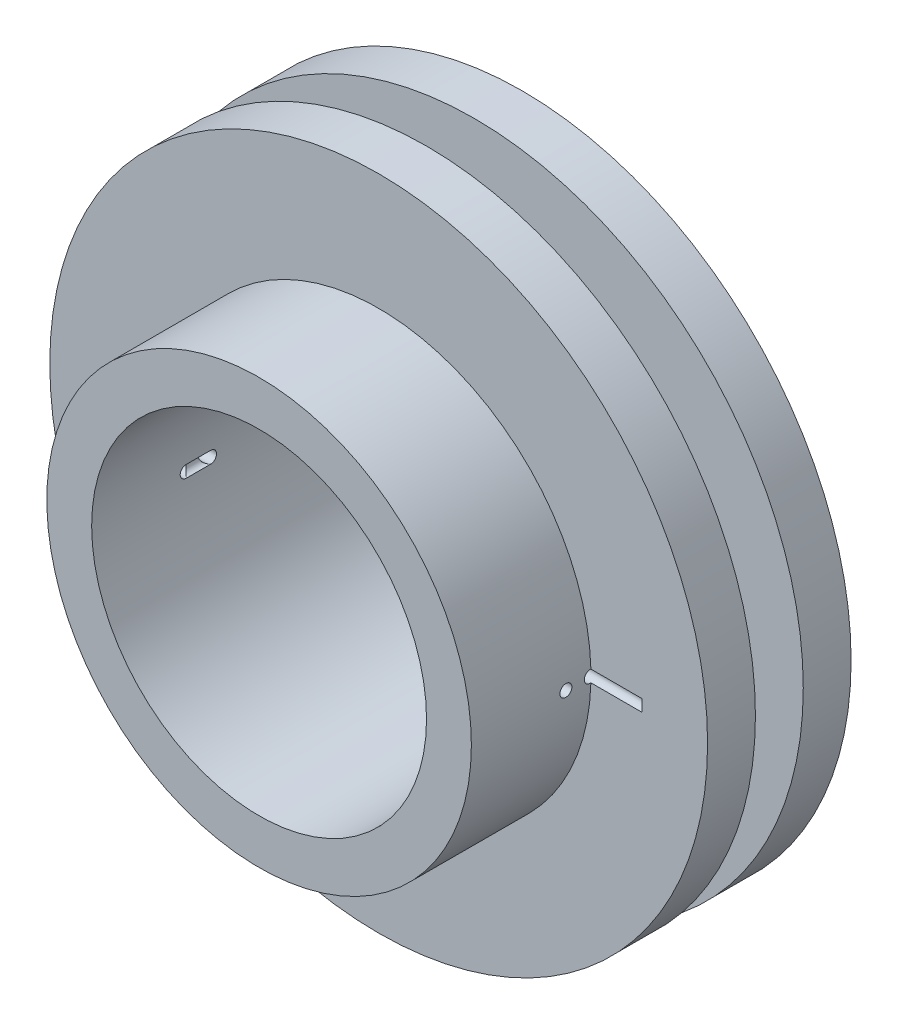
from build123d import *

# Parameters (mm, degrees)
SKETCH1_R               = 13.75
BOSS_EXTRUDE1_DEPTH     = 2
SKETCH2_R               = 8.5
BOSS_EXTRUDE2_DEPTH     = 6
BOSS_EXTRUDE3_START     = 4
SKETCH3_R               = 13.75
BOSS_EXTRUDE3_DEPTH     = 2
SKETCH5_R               = 7
CUT_EXTRUDE2_DEPTH      = 21.350061425
BOSS_EXTRUDE4_START     = 6
SKETCH6_R               = 8.875
SKETCH6_R_2             = 7
BOSS_EXTRUDE4_DEPTH     = 5
CUT_EXTRUDE7_DEPTH      = 11
CUT_EXTRUDE7_DEPTH_BACK = 11
SKETCH17_R              = 0.25
CUT_EXTRUDE13_START     = 6
SKETCH16_R              = 0.25
CUT_EXTRUDE13_DEPTH     = 1


with BuildPart() as part:
    # Sketch1 → Boss-Extrude1 (new body)
    with BuildSketch(Plane.XY):
        Circle(SKETCH1_R)
    extrude(amount=BOSS_EXTRUDE1_DEPTH)

    # Sketch2 → Boss-Extrude2 (add)
    with BuildSketch(Plane.XY):
        Circle(SKETCH2_R)
    extrude(amount=BOSS_EXTRUDE2_DEPTH)

    # Sketch3 → Boss-Extrude3 (add)
    with BuildSketch(Plane.XY.offset(BOSS_EXTRUDE3_START)):
        Circle(SKETCH3_R)
    extrude(amount=BOSS_EXTRUDE3_DEPTH)

    # Sketch5 → Cut-Extrude2 (cut, through all)
    with BuildSketch(Plane.XY):
        Circle(SKETCH5_R)
    extrude(amount=CUT_EXTRUDE2_DEPTH, mode=Mode.SUBTRACT)

    # Sketch6 → Boss-Extrude4 (add)
    with BuildSketch(Plane.XY.offset(BOSS_EXTRUDE4_START)):
        Circle(SKETCH6_R)
        Circle(SKETCH6_R_2, mode=Mode.SUBTRACT)
    extrude(amount=BOSS_EXTRUDE4_DEPTH)

    # Sketch17 → Cut-Extrude7 (cut, two sides: drawn at the far end of the back side and taken through both)
    with BuildSketch(Plane(origin=(0, 0, 0), x_dir=(0, 0, -1), z_dir=(1, 0, 0)).offset(-CUT_EXTRUDE7_DEPTH_BACK)):
        with Locations(Location((-6.029707429, 0, 0), (0, 0, 180))):
            Circle(SKETCH17_R)
        with Locations(Location((-7.048386429, 0, 0), (0, 0, 180))):
            Circle(SKETCH17_R)
    extrude(amount=CUT_EXTRUDE7_DEPTH + CUT_EXTRUDE7_DEPTH_BACK, mode=Mode.SUBTRACT)

    # Sketch16 → Cut-Extrude13 (cut)
    with BuildSketch(Plane.XY.offset(CUT_EXTRUDE13_START)):
        with Locations((-7, 0)):
            Circle(SKETCH16_R)
        with Locations((7, 0)):
            Circle(SKETCH16_R)
    extrude(amount=CUT_EXTRUDE13_DEPTH, mode=Mode.SUBTRACT)


solid = part.part
